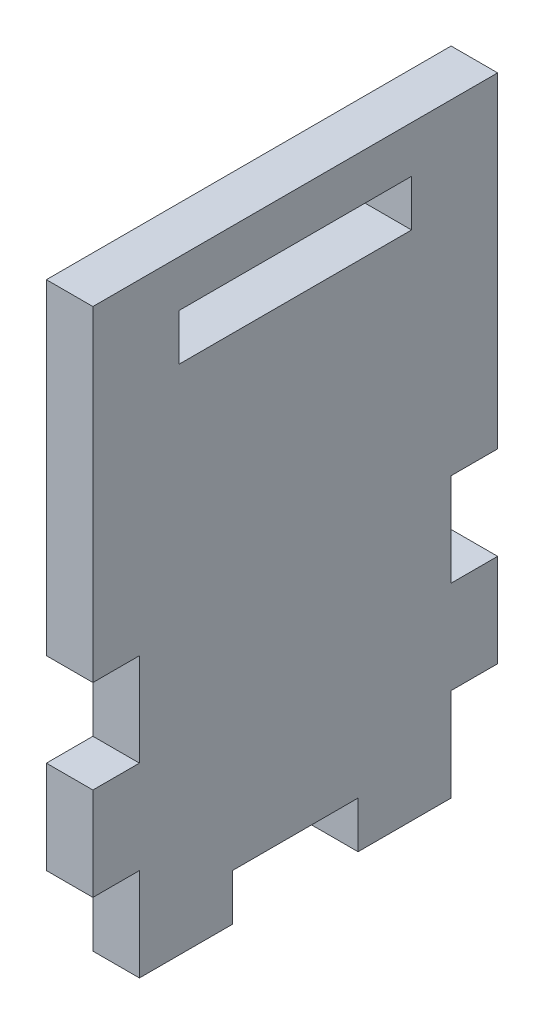
from build123d import *

# Parameters (mm, degrees)
PAREDEESBOCO_W = 15
PAREDEESBOCO_H = 3
PAREDE_DEPTH   = 3


with BuildPart() as part:
    # ParedeEsboco → Parede (new body)
    with BuildSketch(Plane(origin=(0, 0, 0), x_dir=(0, 0, -1), z_dir=(1, 0, 0))):
        Polygon((13.05, -13.5), (10.05, -13.5), (10.05, -19.5), (4.05, -19.5), (4.05, -16.5), (-4.05, -16.5), (-4.05, -19.5), (-10.05, -19.5), (-10.05, -13.5), (-13.05, -13.5), (-13.05, -7.5), (-10.05, -7.5), (-10.05, -1.5), (-13.05, -1.5), (-13.05, 10.5), (-13.05, 19.5), (13.05, 19.5), (13.05, 10.5), (13.05, -1.5), (10.05, -1.5), (10.05, -7.5), (13.05, -7.5), align=None)
        with Locations((0, 15)):
            Rectangle(PAREDEESBOCO_W, PAREDEESBOCO_H, mode=Mode.SUBTRACT)
    extrude(amount=PAREDE_DEPTH)


solid = part.part
